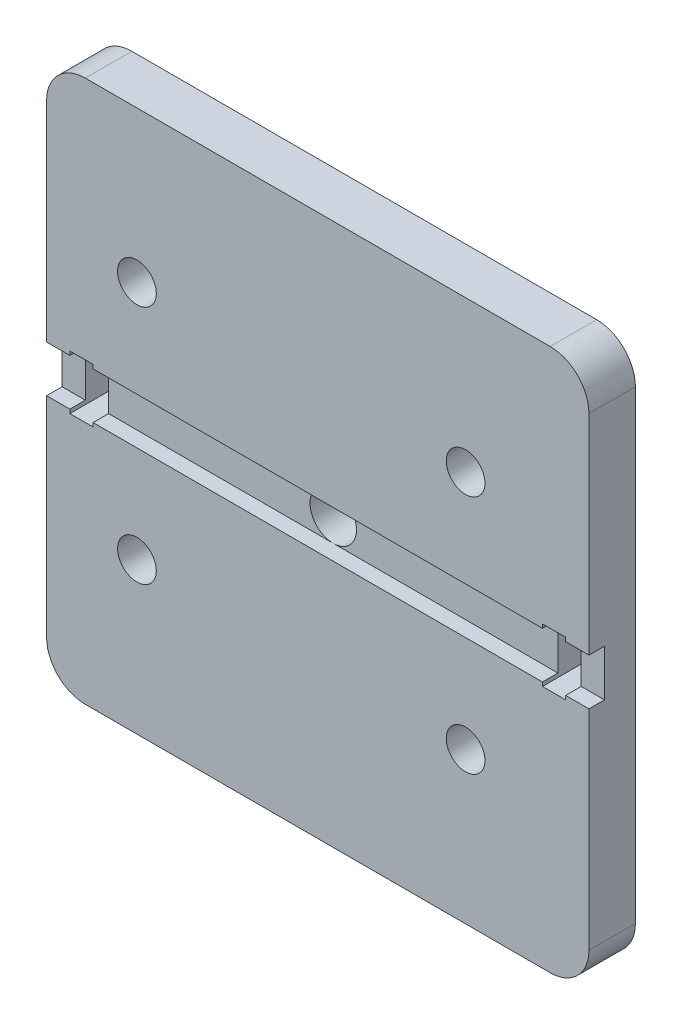
from build123d import *

# Parameters (mm, degrees)
SKETCH1_W           = 3
SKETCH1_H           = 7
BOSS_EXTRUDE1_DEPTH = 6
SKETCH5_W           = 70
SKETCH5_H           = 6
CUT_EXTRUDE2_DEPTH  = 2
SKETCH6_R           = 3
CUT_EXTRUDE3_DEPTH  = 10


with BuildPart() as part:
    # Sketch1 → Boss-Extrude1 (new body)
    # profile 1 of 3: a face of its own
    with BuildSketch(Plane.XY):
        with BuildLine():
            ThreePointArc((0.112083698, 404.617647059), (2.612083698, 407.117647059), (5.112083698, 404.617647059))
            Line((5.112083698, 404.617647059), (18.529411765, 404.617647059))
            Line((18.529411765, 404.617647059), (18.529411765, 419.117647059))
            ThreePointArc((18.529411765, 419.117647059), (17.064945671, 422.653180965), (13.529411765, 424.117647059))
            Line((13.529411765, 424.117647059), (-46.470588235, 424.117647059))
            ThreePointArc((-46.470588235, 424.117647059), (-50.006122141, 422.653180965), (-51.470588235, 419.117647059))
            Line((-51.470588235, 419.117647059), (-51.470588235, 404.617647059))
            Line((-51.470588235, 404.617647059), (-42.310598324, 404.617647059))
            ThreePointArc((-42.310598324, 404.617647059), (-39.810598324, 407.117647059), (-37.310598324, 404.617647059))
            Line((-37.310598324, 404.617647059), (0.112083698, 404.617647059))
        make_face()
    # profile 2 of 3: a face of its own
    with BuildSketch(Plane.XY):
        with BuildLine():
            Line((18.529411765, 404.617647059), (5.112083698, 404.617647059))
            ThreePointArc((5.112083698, 404.617647059), (2.612083698, 402.117647059), (0.112083698, 404.617647059))
            Line((0.112083698, 404.617647059), (-37.310598324, 404.617647059))
            ThreePointArc((-37.310598324, 404.617647059), (-39.810598324, 402.117647059), (-42.310598324, 404.617647059))
            Line((-42.310598324, 404.617647059), (-51.470588235, 404.617647059))
            Line((-51.470588235, 404.617647059), (-51.470588235, 373.617647059))
            Line((-51.470588235, 373.617647059), (-42.310598324, 373.617647059))
            ThreePointArc((-42.310598324, 373.617647059), (-39.810598324, 376.117647059), (-37.310598324, 373.617647059))
            Line((-37.310598324, 373.617647059), (0.112083698, 373.617647059))
            ThreePointArc((0.112083698, 373.617647059), (2.612083698, 376.117647059), (5.112083698, 373.617647059))
            Line((5.112083698, 373.617647059), (18.529411765, 373.617647059))
            Line((18.529411765, 373.617647059), (18.529411765, 404.617647059))
        make_face()
        with Locations((-46.970588235, 389.117647059)):
            Rectangle(SKETCH1_W, SKETCH1_H, mode=Mode.SUBTRACT)
        with Locations((14.029411765, 389.117647059)):
            Rectangle(SKETCH1_W, SKETCH1_H, mode=Mode.SUBTRACT)
    # profile 3 of 3: a face of its own
    with BuildSketch(Plane.XY):
        with BuildLine():
            Line((18.529411765, 359.117647059), (18.529411765, 373.617647059))
            Line((18.529411765, 373.617647059), (5.112083698, 373.617647059))
            ThreePointArc((5.112083698, 373.617647059), (2.612083698, 371.117647059), (0.112083698, 373.617647059))
            Line((0.112083698, 373.617647059), (-37.310598324, 373.617647059))
            ThreePointArc((-37.310598324, 373.617647059), (-39.810598324, 371.117647059), (-42.310598324, 373.617647059))
            Line((-42.310598324, 373.617647059), (-51.470588235, 373.617647059))
            Line((-51.470588235, 373.617647059), (-51.470588235, 359.117647059))
            ThreePointArc((-51.470588235, 359.117647059), (-50.006122141, 355.582113153), (-46.470588235, 354.117647059))
            Line((-46.470588235, 354.117647059), (13.529411765, 354.117647059))
            ThreePointArc((13.529411765, 354.117647059), (17.064945671, 355.582113153), (18.529411765, 359.117647059))
        make_face()
    extrude(amount=BOSS_EXTRUDE1_DEPTH)

    # Sketch5 → Cut-Extrude2 (cut)
    with BuildSketch(Plane.XY.offset(6)):
        with Locations((-16.470588235, 389.117647059)):
            Rectangle(SKETCH5_W, SKETCH5_H)
    extrude(amount=-CUT_EXTRUDE2_DEPTH, mode=Mode.SUBTRACT)

    # Sketch6 → Cut-Extrude3 (cut)
    with BuildSketch(Plane.XY.offset(4)):
        with Locations((-16.470588235, 389.117647059)):
            Circle(SKETCH6_R)
    extrude(amount=-CUT_EXTRUDE3_DEPTH, mode=Mode.SUBTRACT)


solid = part.part
